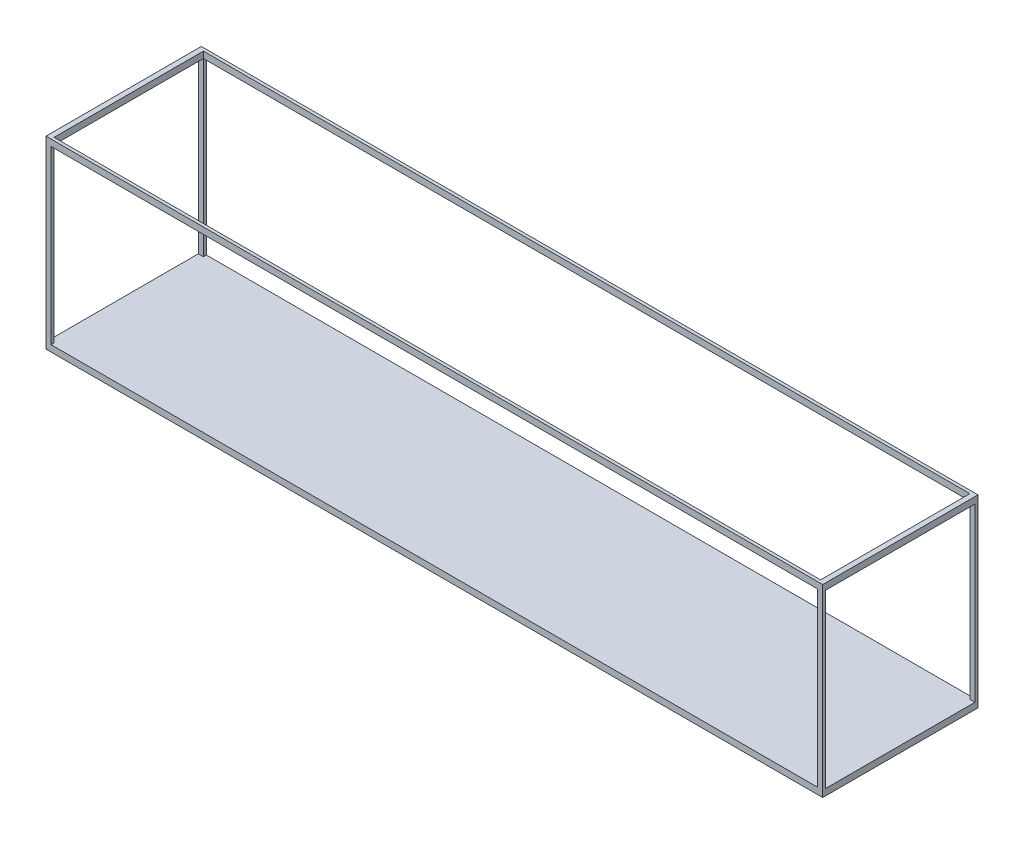
from build123d import *

# Parameters (mm, degrees)
SKETCH1_W           = 12192
SKETCH1_H           = 2896
SKETCH1_W_2         = 12032
SKETCH1_H_2         = 2695
BOSS_EXTRUDE1_DEPTH = 2438
SKETCH5_W           = 12032
SKETCH5_H           = 2344
CUT_EXTRUDE2_DEPTH  = 100.5
SKETCH6_W           = 2344
SKETCH6_H           = 2695
CUT_EXTRUDE5_DEPTH  = 12745.162178487


with BuildPart() as part:
    # Sketch1 → Boss-Extrude1 (new body)
    with BuildSketch(Plane.XY):
        with Locations((6010.686556927, 1349.313288066)):
            Rectangle(SKETCH1_W, SKETCH1_H)
        with Locations((6010.686556927, 1349.313288066)):
            Rectangle(SKETCH1_W_2, SKETCH1_H_2, mode=Mode.SUBTRACT)
    extrude(amount=BOSS_EXTRUDE1_DEPTH)

    # Sketch5 → Cut-Extrude2 (cut)
    with BuildSketch(Plane(origin=(0, 2797.313288066, 0), x_dir=(1, 0, 0), z_dir=(0, 1, 0))):
        with Locations((6010.686556927, -1219)):
            Rectangle(SKETCH5_W, SKETCH5_H)
    extrude(amount=-CUT_EXTRUDE2_DEPTH, mode=Mode.SUBTRACT)

    # Sketch6 → Cut-Extrude5 (cut, through all)
    with BuildSketch(Plane(origin=(12106.686556927, 0, 0), x_dir=(0, 0, -1), z_dir=(1, 0, 0))):
        with Locations((-1219, 1349.313288066)):
            Rectangle(SKETCH6_W, SKETCH6_H)
    extrude(amount=-CUT_EXTRUDE5_DEPTH, mode=Mode.SUBTRACT)


solid = part.part
